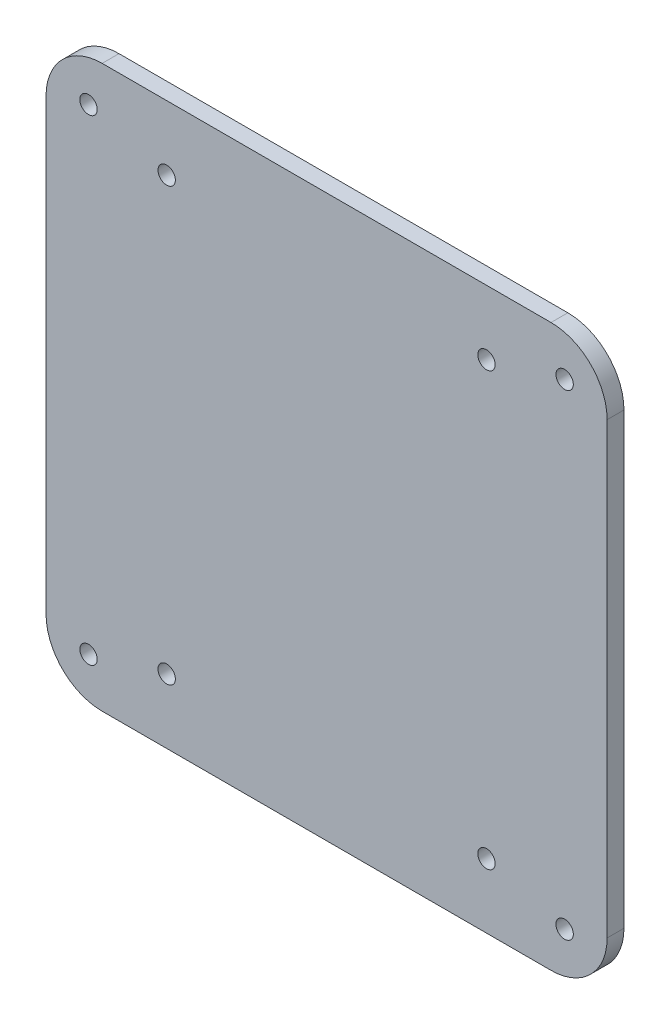
from build123d import *

# Parameters (mm, degrees)
SKETCH_1_R      = 1.55
EXTRUDE_1_DEPTH = 3


with BuildPart() as part:
    # 草图1 → 凸台-拉伸1 (new body)
    with BuildSketch(Plane.XY):
        with BuildLine():
            Line((-40, -50), (40, -50))
            ThreePointArc((40, -50), (47.071067812, -47.071067812), (50, -40))
            Line((50, -40), (50, 40))
            ThreePointArc((50, 40), (47.071067812, 47.071067812), (40, 50))
            Line((40, 50), (-40, 50))
            ThreePointArc((-40, 50), (-47.071067812, 47.071067812), (-50, 40))
            Line((-50, 40), (-50, -40))
            ThreePointArc((-50, -40), (-47.071067812, -47.071067812), (-40, -50))
        make_face()
        with Locations((-28.5, 38.5)):
            Circle(SKETCH_1_R, mode=Mode.SUBTRACT)
        with Locations((28.5, 38.5)):
            Circle(SKETCH_1_R, mode=Mode.SUBTRACT)
        with Locations((28.5, -38.5)):
            Circle(SKETCH_1_R, mode=Mode.SUBTRACT)
        with Locations((-28.5, -38.5)):
            Circle(SKETCH_1_R, mode=Mode.SUBTRACT)
        with Locations((-42.426406871, 42.426406871)):
            Circle(SKETCH_1_R, mode=Mode.SUBTRACT)
        with Locations(Location((42.426406871, 42.426406871, 0), (0, 0, 180))):
            Circle(SKETCH_1_R, mode=Mode.SUBTRACT)
        with Locations((42.426406871, -42.426406871)):
            Circle(SKETCH_1_R, mode=Mode.SUBTRACT)
        with Locations(Location((-42.426406871, -42.426406871, 0), (0, 0, 180))):
            Circle(SKETCH_1_R, mode=Mode.SUBTRACT)
    extrude(amount=EXTRUDE_1_DEPTH)


solid = part.part
